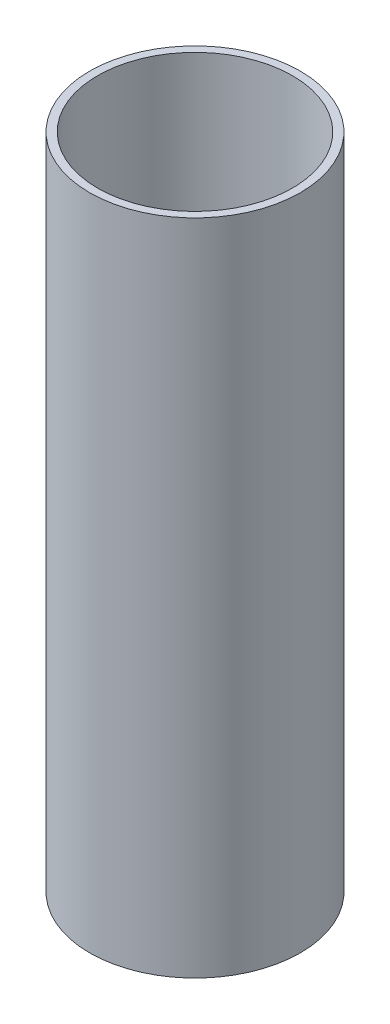
from build123d import *

# Parameters (mm, degrees)
SKETCH1_R           = 16
SKETCH1_R_2         = 14.8
BOSS_EXTRUDE1_DEPTH = 100
SKETCH2_R           = 3.25
CUT_EXTRUDE1_DEPTH  = 103.528044944


with BuildPart() as part:
    # Sketch1 → Boss-Extrude1 (new body)
    with BuildSketch(Plane(origin=(0, 0, 0), x_dir=(1, 0, 0), z_dir=(0, 1, 0))):
        with Locations(Location((0, 0, 0), (0, 0, 270))):
            Circle(SKETCH1_R)
        with Locations(Location((0, 0, 0), (0, 0, 270))):
            Circle(SKETCH1_R_2, mode=Mode.SUBTRACT)
    extrude(amount=BOSS_EXTRUDE1_DEPTH)

    # Sketch2 → Cut-Extrude1 (cut, through all)
    with BuildSketch(Plane(origin=(0, 0, 0), x_dir=(0, 0, -1), z_dir=(1, 0, 0))):
        with Locations((0, 50)):
            Circle(SKETCH2_R)
    extrude(amount=-CUT_EXTRUDE1_DEPTH, mode=Mode.SUBTRACT)


solid = part.part
